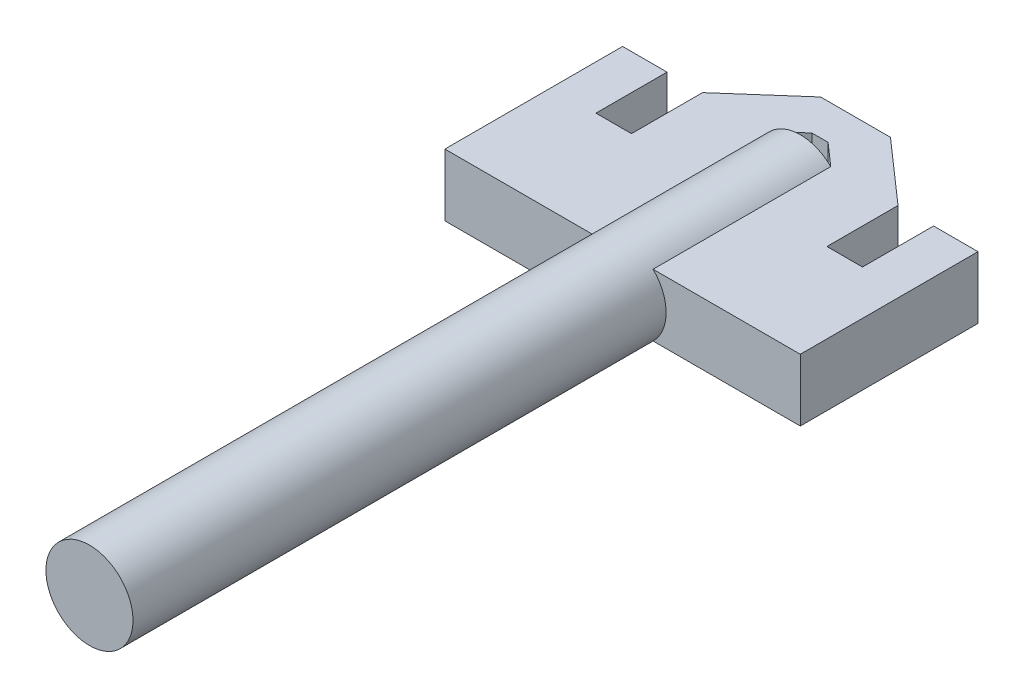
from build123d import *

# Parameters (mm, degrees)
SKETCH2_R           = 2.45
BOSS_EXTRUDE1_DEPTH = 40
SKETCH3_W           = 20
SKETCH3_H           = 3.5
BOSS_EXTRUDE2_DEPTH = 10
SKETCH4_W           = 2
SKETCH4_H           = 3.5
CUT_EXTRUDE1_DEPTH  = 4
BOSS_EXTRUDE3_START = -1.75
BOSS_EXTRUDE3_DEPTH = 3.5


with BuildPart() as part:
    # Sketch2 → Boss-Extrude1 (new body)
    with BuildSketch(Plane.XY):
        Circle(SKETCH2_R)
    extrude(amount=BOSS_EXTRUDE1_DEPTH)

    # Sketch3 → Boss-Extrude2 (add)
    with BuildSketch(Plane(origin=(0, 0, 0), x_dir=(-1, 0, 0), z_dir=(0, 0, -1))):
        Rectangle(SKETCH3_W, SKETCH3_H)
    extrude(amount=-BOSS_EXTRUDE2_DEPTH)

    # Sketch4 → Cut-Extrude1 (cut)
    with BuildSketch(Plane(origin=(0, 0, 0), x_dir=(-1, 0, 0), z_dir=(0, 0, -1))):
        with Locations((-6.5, 0)):
            Rectangle(SKETCH4_W, SKETCH4_H)
        with Locations((6.5, 0)):
            Rectangle(SKETCH4_W, SKETCH4_H)
    extrude(amount=-CUT_EXTRUDE1_DEPTH, mode=Mode.SUBTRACT)

    # Sketch5 → Boss-Extrude3 (add)
    with BuildSketch(Plane(origin=(0, 0, 0), x_dir=(1, 0, 0), z_dir=(0, 1, 0)).offset(BOSS_EXTRUDE3_START)):
        Polygon((-1.71464282, 0), (-0.45349465, 1.109249464), (0.45349465, 1.109249464), (1.71464282, 0), (5.5, 0), (1.964975284, 3.109249464), (-1.964975284, 3.109249464), (-5.5, 0), align=None)
    extrude(amount=BOSS_EXTRUDE3_DEPTH)


solid = part.part
